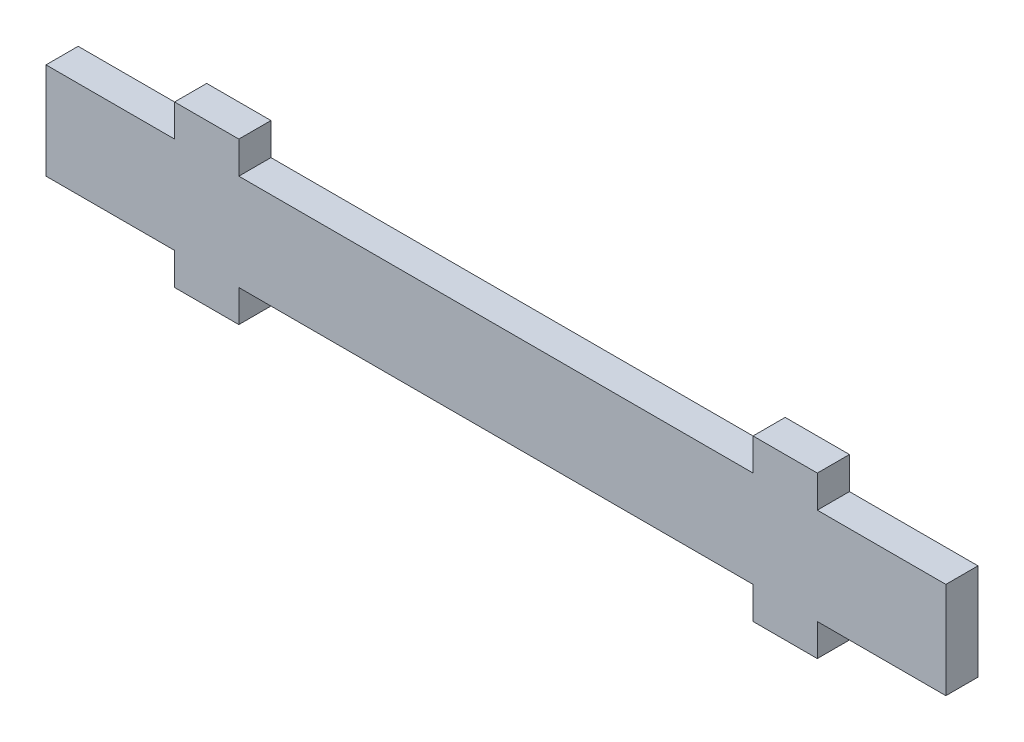
from build123d import *

# Parameters (mm, degrees)
SKETCH1_W           = 177.8
SKETCH1_H           = 19.05
BOSS_EXTRUDE1_DEPTH = 6.35
SKETCH2_W           = 12.7
SKETCH2_H           = 6.35
BOSS_EXTRUDE2_DEPTH = 6.35
SKETCH3_W           = 12.7
SKETCH3_H           = 6.35
BOSS_EXTRUDE3_DEPTH = 6.35


with BuildPart() as part:
    # Sketch1 → Boss-Extrude1 (new body)
    with BuildSketch(Plane.XY):
        with Locations((88.9, 9.525)):
            Rectangle(SKETCH1_W, SKETCH1_H)
    extrude(amount=BOSS_EXTRUDE1_DEPTH)

    # Sketch2 → Boss-Extrude2 (add)
    with BuildSketch(Plane(origin=(0, 19.05, 0), x_dir=(1, 0, 0), z_dir=(0, 1, 0))):
        with Locations((31.75, -3.175)):
            Rectangle(SKETCH2_W, SKETCH2_H)
        with Locations((146.05, -3.175)):
            Rectangle(SKETCH2_W, SKETCH2_H)
    extrude(amount=BOSS_EXTRUDE2_DEPTH)

    # Sketch3 → Boss-Extrude3 (add)
    with BuildSketch(Plane.XZ):
        with Locations((31.75, 3.175)):
            Rectangle(SKETCH3_W, SKETCH3_H)
        with Locations((146.05, 3.175)):
            Rectangle(SKETCH3_W, SKETCH3_H)
    extrude(amount=BOSS_EXTRUDE3_DEPTH)


solid = part.part
